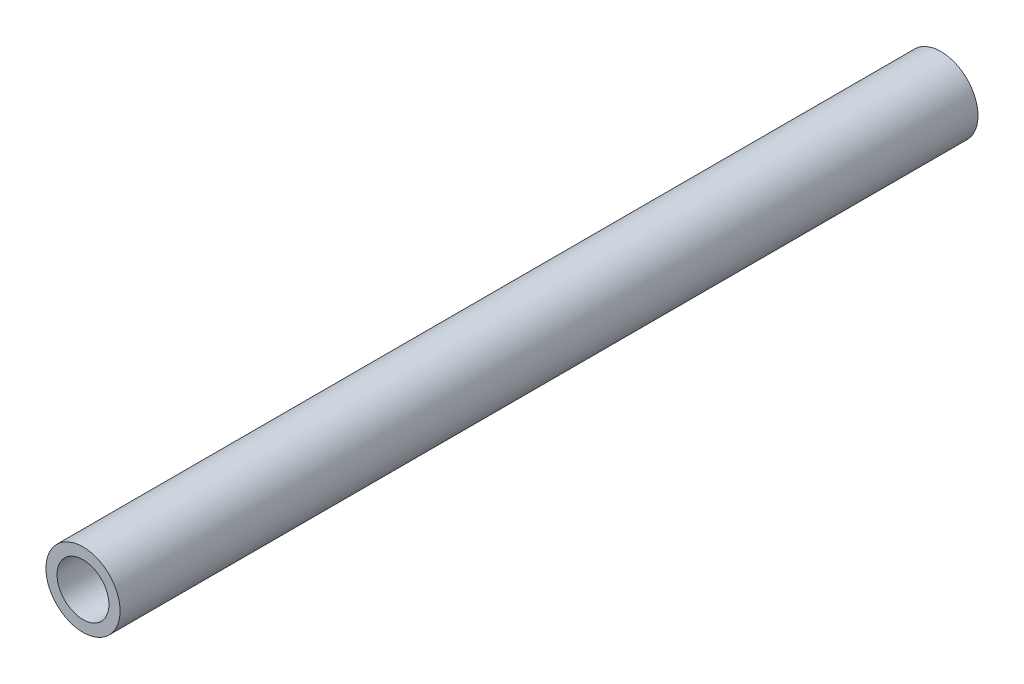
from build123d import *

# Parameters (mm, degrees)
SKETCH1_R           = 12.7
BOSS_EXTRUDE1_DEPTH = 294
SKETCH2_R           = 8.89
CUT_EXTRUDE1_DEPTH  = 295.548094545


with BuildPart() as part:
    # Sketch1 → Boss-Extrude1 (new body)
    with BuildSketch(Plane.XY):
        Circle(SKETCH1_R)
    extrude(amount=BOSS_EXTRUDE1_DEPTH)

    # Sketch2 → Cut-Extrude1 (cut, through all)
    with BuildSketch(Plane.XY.offset(294)):
        Circle(SKETCH2_R)
    extrude(amount=-CUT_EXTRUDE1_DEPTH, mode=Mode.SUBTRACT)


solid = part.part
